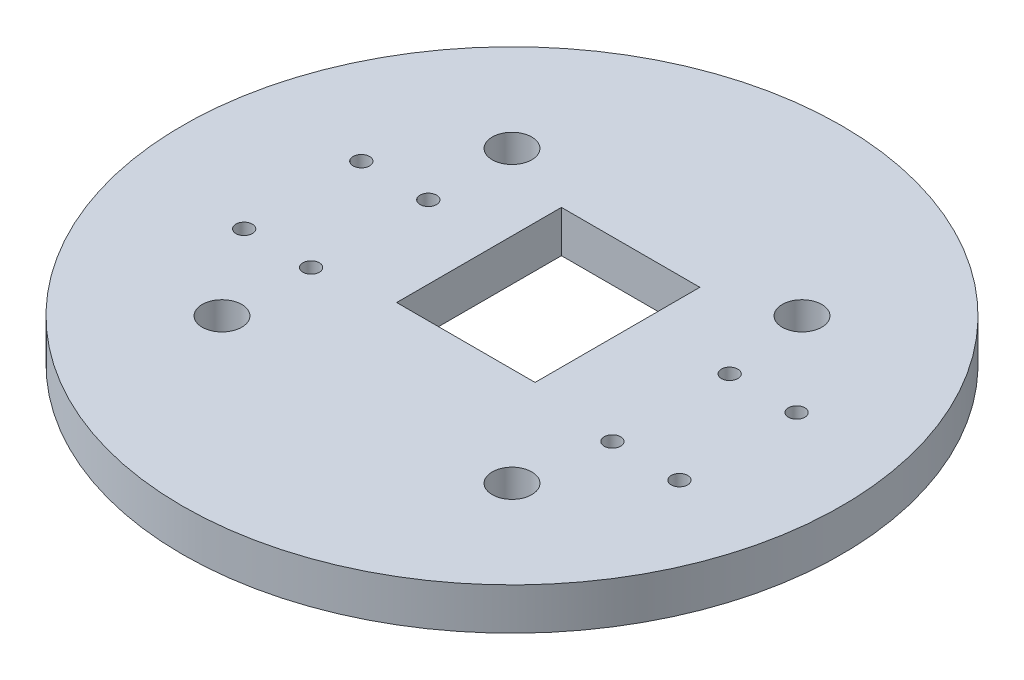
from build123d import *

# Parameters (mm, degrees)
SKETCH1_R             = 50
SKETCH1_R_2           = 3
SKETCH1_W             = 21
SKETCH1_H             = 25
BOSS_EXTRUDE1_DEPTH   = 6.35
M3X0_5_TAPPED_HOLE1_D = 2.5


with BuildPart() as part:
    # Sketch1 → Boss-Extrude1 (new body)
    with BuildSketch(Plane(origin=(0, 0, 0), x_dir=(1, 0, 0), z_dir=(0, 1, 0))):
        with Locations(Location((0, 0, 0), (0, 0, 270))):
            Circle(SKETCH1_R)
        with Locations(Location((22, 22, 0), (0, 0, 270))):
            Circle(SKETCH1_R_2, mode=Mode.SUBTRACT)
        with Locations(Location((-22, 22, 0), (0, 0, 270))):
            Circle(SKETCH1_R_2, mode=Mode.SUBTRACT)
        with Locations(Location((-22, -22, 0), (0, 0, 270))):
            Circle(SKETCH1_R_2, mode=Mode.SUBTRACT)
        with Locations(Location((22, -22, 0), (0, 0, 270))):
            Circle(SKETCH1_R_2, mode=Mode.SUBTRACT)
        with Locations((0, 5.5)):
            Rectangle(SKETCH1_W, SKETCH1_H, mode=Mode.SUBTRACT)
    extrude(amount=BOSS_EXTRUDE1_DEPTH)

    # M3x0.5 Tapped Hole1 (through all)
    with Locations(Plane(origin=(0, 0, 0), x_dir=(-1, 0, 0), z_dir=(0, -1, 0))):
        with Locations((21.59, 8.89), (-24.13, 8.89), (-24.13, -8.89), (21.59, -8.89), (31.75, 8.89), (-34.29, 8.89), (31.75, -8.89), (-34.29, -8.89)):
            Hole(M3X0_5_TAPPED_HOLE1_D / 2)


solid = part.part
